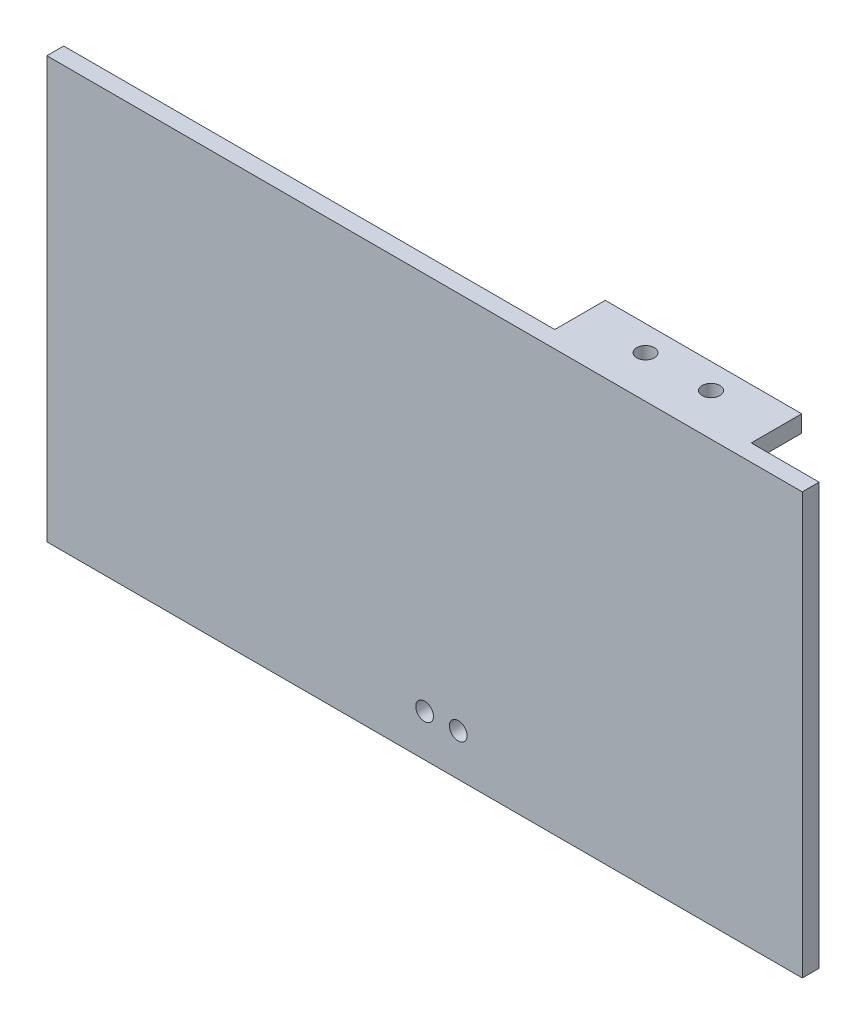
from build123d import *

# Parameters (mm, degrees)
SKETCH1_W           = 134.58
SKETCH1_H           = 3
BOSS_EXTRUDE1_DEPTH = 75
SKETCH2_W           = 35
SKETCH2_H           = 3
BOSS_EXTRUDE2_DEPTH = 9
SKETCH3_R           = 1.575
CUT_EXTRUDE1_DEPTH  = 155.534062265
SKETCH4_R           = 1.575
CUT_EXTRUDE2_DEPTH  = 155.534062265


with BuildPart() as part:
    # Sketch1 → Boss-Extrude1 (new body)
    with BuildSketch(Plane(origin=(0, 0, 0), x_dir=(1, 0, 0), z_dir=(0, 1, 0))):
        with Locations((67.29, 1.5)):
            Rectangle(SKETCH1_W, SKETCH1_H)
    extrude(amount=BOSS_EXTRUDE1_DEPTH)

    # Sketch2 → Boss-Extrude2 (add)
    with BuildSketch(Plane(origin=(0, 0, -3), x_dir=(-1, 0, 0), z_dir=(0, 0, -1))):
        with Locations((-104.98, 73.5)):
            Rectangle(SKETCH2_W, SKETCH2_H)
    extrude(amount=BOSS_EXTRUDE2_DEPTH)

    # Sketch3 → Cut-Extrude1 (cut, through all)
    with BuildSketch(Plane(origin=(0, 75, 0), x_dir=(1, 0, 0), z_dir=(0, 1, 0))):
        with Locations(Location((110.813333333, 7.5, 0), (0, 0, 270))):
            Circle(SKETCH3_R)
        with Locations(Location((99.146666667, 7.5, 0), (0, 0, 270))):
            Circle(SKETCH3_R)
    extrude(amount=-CUT_EXTRUDE1_DEPTH, mode=Mode.SUBTRACT)

    # Sketch4 → Cut-Extrude2 (cut, through all)
    with BuildSketch(Plane.XY):
        with Locations((73.29, 7.5)):
            Circle(SKETCH4_R)
        with Locations((67.29, 7.5)):
            Circle(SKETCH4_R)
    extrude(amount=-CUT_EXTRUDE2_DEPTH, mode=Mode.SUBTRACT)


solid = part.part
